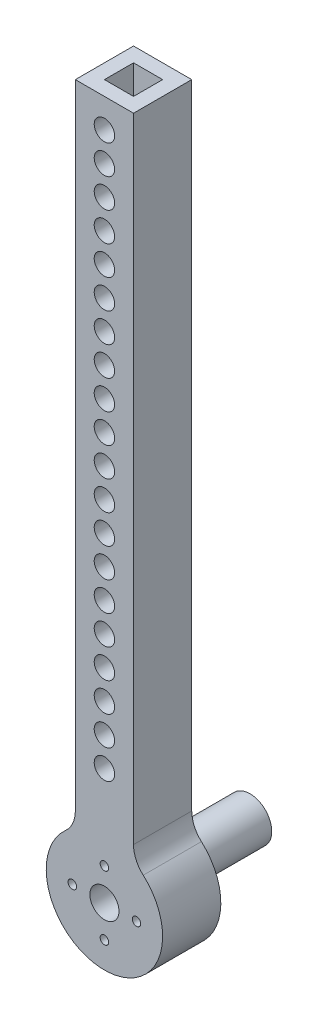
from build123d import *

# Parameters (mm, degrees)
SKETCH1_W           = 12.7
SKETCH1_H           = 12.7
SKETCH1_W_2         = 6.35
SKETCH1_H_2         = 6.35
BOSS_EXTRUDE1_DEPTH = 152.4
SKETCH2_R           = 2.226999991
CUT_EXTRUDE1_DEPTH  = 154.060029074
SKETCH3_R           = 12.7
BOSS_EXTRUDE2_DEPTH = 12.7
SKETCH4_R           = 4.7625
BOSS_EXTRUDE3_DEPTH = 31.75
SKETCH6_R           = 3.175
SKETCH6_R_2         = 0.927000051
CUT_EXTRUDE3_DEPTH  = 157.189348228
FILLET2_R           = 6.35


with BuildPart() as part:
    # Sketch1 → Boss-Extrude1 (new body)
    with BuildSketch(Plane(origin=(0, 0, 0), x_dir=(1, 0, 0), z_dir=(0, 1, 0))):
        Rectangle(SKETCH1_W, SKETCH1_H)
        Rectangle(SKETCH1_W_2, SKETCH1_H_2, mode=Mode.SUBTRACT)
    extrude(amount=BOSS_EXTRUDE1_DEPTH)

    # Sketch2 → Cut-Extrude1 (cut, through all)
    with BuildSketch(Plane.XY.offset(6.35)):
        with Locations((0, 25.4)):
            Circle(SKETCH2_R)
        with Locations((0, 31.75)):
            Circle(SKETCH2_R)
        with Locations((0, 38.1)):
            Circle(SKETCH2_R)
        with Locations((0, 44.45)):
            Circle(SKETCH2_R)
        with Locations((0, 50.8)):
            Circle(SKETCH2_R)
        with Locations((0, 57.15)):
            Circle(SKETCH2_R)
        with Locations((0, 63.5)):
            Circle(SKETCH2_R)
        with Locations((0, 69.85)):
            Circle(SKETCH2_R)
        with Locations((0, 76.2)):
            Circle(SKETCH2_R)
        with Locations((0, 82.55)):
            Circle(SKETCH2_R)
        with Locations((0, 88.9)):
            Circle(SKETCH2_R)
        with Locations((0, 95.25)):
            Circle(SKETCH2_R)
        with Locations((0, 101.6)):
            Circle(SKETCH2_R)
        with Locations((0, 107.95)):
            Circle(SKETCH2_R)
        with Locations((0, 114.3)):
            Circle(SKETCH2_R)
        with Locations((0, 120.65)):
            Circle(SKETCH2_R)
        with Locations((0, 127)):
            Circle(SKETCH2_R)
        with Locations((0, 133.35)):
            Circle(SKETCH2_R)
        with Locations((0, 139.7)):
            Circle(SKETCH2_R)
        with Locations((0, 146.05)):
            Circle(SKETCH2_R)
    extrude(amount=-CUT_EXTRUDE1_DEPTH, mode=Mode.SUBTRACT)

    # Sketch3 → Boss-Extrude2 (add)
    with BuildSketch(Plane.XY.offset(6.35)):
        Circle(SKETCH3_R)
    extrude(amount=-BOSS_EXTRUDE2_DEPTH)

    # Sketch4 → Boss-Extrude3 (add)
    with BuildSketch(Plane.XY.offset(6.35)):
        Circle(SKETCH4_R)
    extrude(amount=-BOSS_EXTRUDE3_DEPTH)

    # Sketch6 → Cut-Extrude3 (cut, through all)
    with BuildSketch(Plane.XY.offset(6.35)):
        Circle(SKETCH6_R)
        with Locations((6.99999997, 0)):
            Circle(SKETCH6_R_2)
        with Locations((0, -6.99999997)):
            Circle(SKETCH6_R_2)
        with Locations((-6.99999997, 0)):
            Circle(SKETCH6_R_2)
        with Locations((0, 6.99999997)):
            Circle(SKETCH6_R_2)
    extrude(amount=-CUT_EXTRUDE3_DEPTH, mode=Mode.SUBTRACT)

    # Fillet2
    fillet2_edges = [part.edges().sort_by_distance(p)[0] for p in [
        (6.35, 10.998522628, 0),
        (-6.35, 10.998522628, 0),
    ]]
    fillet(fillet2_edges, radius=FILLET2_R)


solid = part.part
